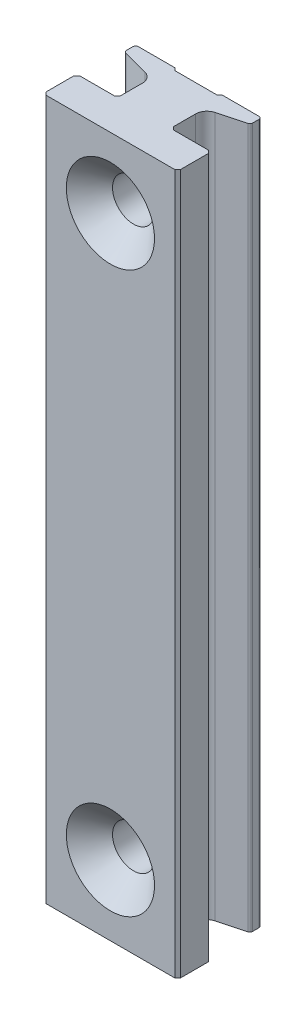
from build123d import *

# Parameters (mm, degrees)
ESQUISSE1_W                                    = 9
ESQUISSE1_H                                    = 50
BOSS_EXTRU_1_DEPTH                             = 6.3
ESQUISSE2_W                                    = 2.6
ESQUISSE2_H                                    = 5.499999997
ENL_V_MAT_EXTRU_1_DEPTH                        = 51.595849632
ESQUISSE3_W                                    = 2.4
ESQUISSE3_H                                    = 50
BOSS_EXTRU_2_DEPTH                             = 2.9
ESQUISSE4_W                                    = 2.6
ESQUISSE4_H                                    = 4.803332101
ENL_V_MAT_EXTRU_2_DEPTH                        = 51.623413555
ESQUISSE5_W                                    = 2.4
ESQUISSE5_H                                    = 50
BOSS_EXTRU_3_DEPTH                             = 2.9
ESQUISSE6_W                                    = 3.04
ESQUISSE6_H                                    = 0.18
ENL_V_MAT_EXTRU_3_DEPTH                        = 51.623413555
D_POUILLE1_ANGLE                               = 14.999999904
D_POUILLE2_ANGLE                               = 14.999999904
D_POUILLE3_ANGLE                               = 45
FRAISAGE_POUR_VIS_T_TE_FRAIS_E_M31_D           = 3
FRAISAGE_POUR_VIS_T_TE_FRAIS_E_M31_CSINK_D     = 6.3
FRAISAGE_POUR_VIS_T_TE_FRAIS_E_M31_CSINK_ANGLE = 90
CHANFREIN1_SIZE                                = 0.2
CONG_1_R                                       = 0.2
CONG_2_R                                       = 0.8


with BuildPart() as part:
    # Esquisse1 → Boss.-Extru.1 (new body)
    with BuildSketch(Plane.XY.offset(6.3)):
        Rectangle(ESQUISSE1_W, ESQUISSE1_H)
    extrude(amount=-BOSS_EXTRU_1_DEPTH)

    # Esquisse2 → Enlèv. mat.-Extru.1 (cut, through all)
    with BuildSketch(Plane(origin=(0, 25, 0), x_dir=(-1, 0, 0), z_dir=(0, 1, 0))):
        with Locations((3.2, 3.550000002)):
            Rectangle(ESQUISSE2_W, ESQUISSE2_H)
    extrude(amount=-ENL_V_MAT_EXTRU_1_DEPTH, mode=Mode.SUBTRACT)

    # Esquisse3 → Boss.-Extru.2 (add)
    with BuildSketch(Plane.ZY.offset(1.9)):
        with Locations((5.1, 0)):
            Rectangle(ESQUISSE3_W, ESQUISSE3_H)
    extrude(amount=BOSS_EXTRU_2_DEPTH)

    # Esquisse4 → Enlèv. mat.-Extru.2 (cut, through all)
    with BuildSketch(Plane(origin=(0, 25, 0), x_dir=(-1, 0, 0), z_dir=(0, 1, 0))):
        with Locations((-3.2, 3.89833395)):
            Rectangle(ESQUISSE4_W, ESQUISSE4_H)
    extrude(amount=-ENL_V_MAT_EXTRU_2_DEPTH, mode=Mode.SUBTRACT)

    # Esquisse5 → Boss.-Extru.3 (add)
    with BuildSketch(Plane(origin=(1.9, 0, 0), x_dir=(0, 0, -1), z_dir=(1, 0, 0))):
        with Locations((-5.1, 0)):
            Rectangle(ESQUISSE5_W, ESQUISSE5_H)
    extrude(amount=BOSS_EXTRU_3_DEPTH)

    # Esquisse6 → Enlèv. mat.-Extru.3 (cut, through all)
    with BuildSketch(Plane.XZ.offset(25)):
        with Locations((0, 0.09)):
            Rectangle(ESQUISSE6_W, ESQUISSE6_H)
    extrude(amount=-ENL_V_MAT_EXTRU_3_DEPTH, mode=Mode.SUBTRACT)

    # Dépouille1
    d_pouille1_faces = [part.faces().sort_by_distance(p)[0] for p in [
        (-3.2, 0, 0.800000003),
    ]]
    draft(d_pouille1_faces, Plane(origin=(-4.5, 25, 0), x_dir=(0, -1, 0), z_dir=(-1, 0, 0)), D_POUILLE1_ANGLE)

    # Dépouille2
    d_pouille2_faces = [part.faces().sort_by_distance(p)[0] for p in [
        (3.2, 0, 1.496667899),
    ]]
    draft(d_pouille2_faces, Plane(origin=(1.9, -25, 1.496667899), x_dir=(0, 0, 1), z_dir=(1, 0, 0)), D_POUILLE2_ANGLE)

    # Dépouille3
    d_pouille3_faces = [part.faces().sort_by_distance(p)[0] for p in [
        (-1.52, 0, 0.09),
        (1.52, 0, 0.09),
    ]]
    draft(d_pouille3_faces, Plane(origin=(1.52, 25, 0.18), x_dir=(-1, 0, 0), z_dir=(0, 0, -1)), D_POUILLE3_ANGLE)

    # Fraisage pour vis à tête fraisée M31 (through all)
    with Locations(Plane.XY.offset(6.3)):
        with Locations((0, 20), (0, -20)):
            CounterSinkHole(FRAISAGE_POUR_VIS_T_TE_FRAIS_E_M31_D / 2, FRAISAGE_POUR_VIS_T_TE_FRAIS_E_M31_CSINK_D / 2, counter_sink_angle=FRAISAGE_POUR_VIS_T_TE_FRAIS_E_M31_CSINK_ANGLE)

    # Chanfrein1
    chanfrein1_edges = [part.edges().sort_by_distance(p)[0] for p in [
        (-1.9, 0, 3.9),
        (-4.8, 0, 6.3),
        (-4.8, 0, 3.9),
        (1.9, 0, 3.9),
        (4.8, 0, 3.9),
        (4.8, 0, 6.3),
    ]]
    chamfer(chanfrein1_edges, length=CHANFREIN1_SIZE)

    # Congé1
    cong_1_edges = [part.edges().sort_by_distance(p)[0] for p in [
        (-4.5, 0, 0),
        (-4.5, 0, 0.800000003),
        (4.5, 0, 0),
        (4.5, 0, 0.800000003),
    ]]
    fillet(cong_1_edges, radius=CONG_1_R)

    # Congé2
    cong_2_edges = [part.edges().sort_by_distance(p)[0] for p in [
        (-1.9, 0, 1.496667899),
        (1.9, 0, 1.496667899),
    ]]
    fillet(cong_2_edges, radius=CONG_2_R)


solid = part.part
